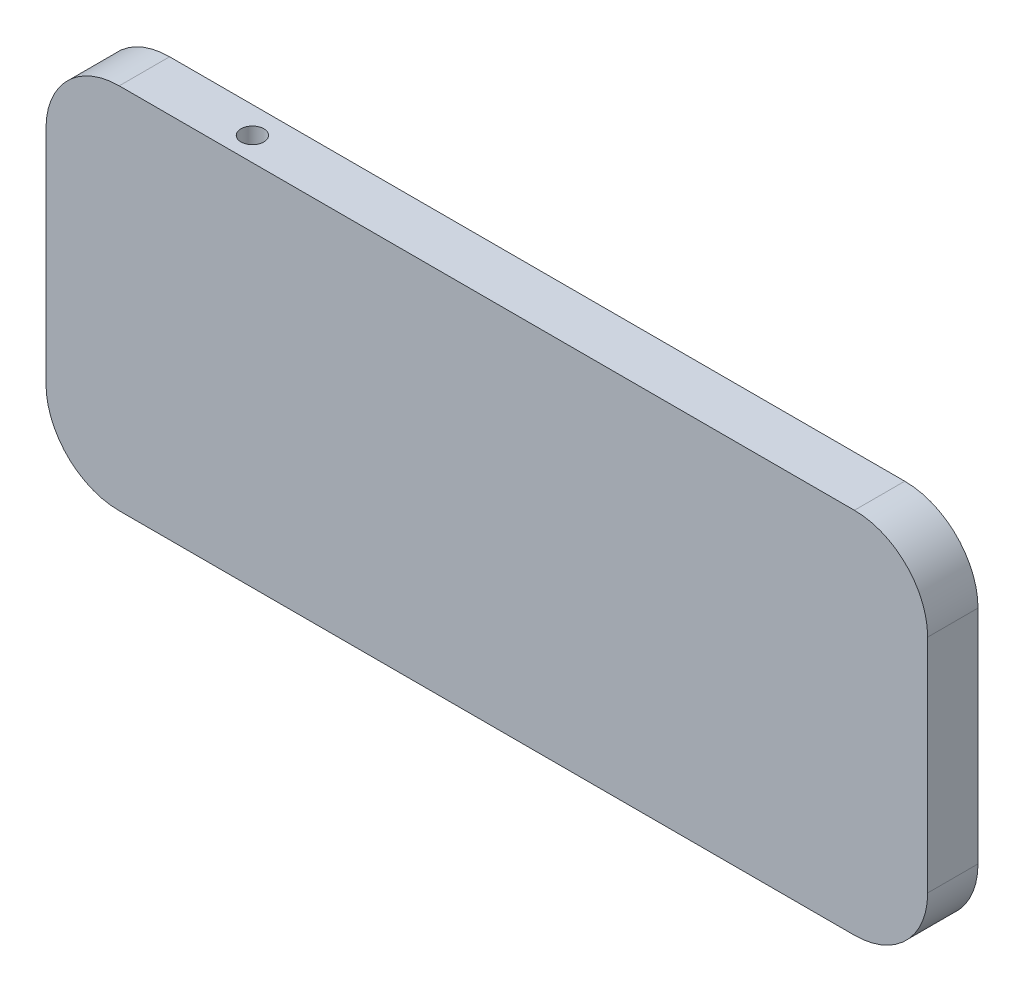
from build123d import *

# Parameters (mm, degrees)
SKETCH1_W           = 172.974
SKETCH1_H           = 102.108
BOSS_EXTRUDE1_DEPTH = 13.97
SKETCH2_R           = 7.4676
SKETCH2_R_2         = 3.014975044
SKETCH2_W           = 7.81218406
SKETCH2_H           = 2.407827673
BOSS_EXTRUDE3_DEPTH = 3.048
SKETCH3_R           = 7.4676
SKETCH3_R_2         = 3.014975044
BOSS_EXTRUDE5_DEPTH = 3.048
SKETCH4_R           = 3.175
CUT_EXTRUDE1_DEPTH  = 11.176


with BuildPart() as part:
    # Sketch1 → Boss-Extrude1 (new body)
    with BuildSketch(Plane.XY):
        with Locations((58.9637029, 33.169946412)):
            Rectangle(SKETCH1_W, SKETCH1_H)
        with BuildLine():
            Line((-27.5232971, 84.223946412), (-43.0172971, 84.223946412))
            ThreePointArc((-43.0172971, 84.223946412), (-57.385706894, 78.272356205), (-63.3372971, 63.903946412))
            Line((-63.3372971, 63.903946412), (-63.3372971, 2.435946412))
            ThreePointArc((-63.3372971, 2.435946412), (-57.385706894, -11.932463382), (-43.0172971, -17.884053588))
            Line((-43.0172971, -17.884053588), (-27.5232971, -17.884053588))
            Line((-27.5232971, -17.884053588), (-27.5232971, 84.223946412))
        make_face()
        with BuildLine():
            Line((160.9447029, 84.223946412), (145.4507029, 84.223946412))
            Line((145.4507029, 84.223946412), (145.4507029, -17.884053588))
            Line((145.4507029, -17.884053588), (160.9447029, -17.884053588))
            ThreePointArc((160.9447029, -17.884053588), (175.313112694, -11.932463382), (181.2647029, 2.435946412))
            Line((181.2647029, 2.435946412), (181.2647029, 63.903946412))
            ThreePointArc((181.2647029, 63.903946412), (175.313112694, 78.272356205), (160.9447029, 84.223946412))
        make_face()
    extrude(amount=BOSS_EXTRUDE1_DEPTH)

    # Sketch2 → Boss-Extrude3 (add)
    with BuildSketch(Plane(origin=(0, 0, 0), x_dir=(-1, 0, 0), z_dir=(0, 0, -1))):
        with Locations(Location((-163.4847029, 58.823946412, 0), (0, 0, 180))):
            Circle(SKETCH2_R)
        with Locations(Location((-170.337090886, 26.676001086, 0), (0, 0, 180))):
            Circle(SKETCH2_R_2)
        with Locations(Location((-163.221177768, 32.823656386, 0), (0, 0, 180))):
            Circle(SKETCH2_R_2)
        with Locations(Location((-156.732358191, 26.205188985, 0), (0, 0, 180))):
            Circle(SKETCH2_R_2)
        with Locations(Location((-163.721455714, 19.973644896, 0), (0, 0, 180))):
            Circle(SKETCH2_R_2)
        with Locations((-152.730393721, 74.856056835)):
            Rectangle(SKETCH2_W, SKETCH2_H)
    extrude(amount=BOSS_EXTRUDE3_DEPTH)

    # Sketch3 → Boss-Extrude5 (add)
    with BuildSketch(Plane(origin=(0, 0, 0), x_dir=(-1, 0, 0), z_dir=(0, 0, -1))):
        with Locations(Location((45.487523866, 28.516423037, 0), (0, 0, 180))):
            Circle(SKETCH3_R)
        with Locations(Location((44.957454366, 53.116068624, 0), (0, 0, 180))):
            Circle(SKETCH3_R_2)
        with Locations(Location((38.341819194, 59.818424813, 0), (0, 0, 180))):
            Circle(SKETCH3_R_2)
        with Locations(Location((45.457732312, 65.966080113, 0), (0, 0, 180))):
            Circle(SKETCH3_R_2)
        with Locations(Location((51.94655189, 59.347612713, 0), (0, 0, 180))):
            Circle(SKETCH3_R_2)
        Polygon((38.47340824, 76.391412748), (41.190295926, 76.391412748), (41.190295926, 73.983585075), (38.47340824, 73.983585075), (38.47340824, 71.443585075), (35.93340824, 71.443585075), (35.93340824, 73.983585075), (33.570295926, 73.983585075), (33.570295926, 76.391412748), (35.93340824, 76.391412748), (35.93340824, 78.931412748), (38.47340824, 78.931412748), align=None)
    extrude(amount=BOSS_EXTRUDE5_DEPTH)

    # Sketch4 → Cut-Extrude1 (cut)
    with BuildSketch(Plane(origin=(0, 84.223946412, 0), x_dir=(1, 0, 0), z_dir=(0, 1, 0))):
        with Locations(Location((-12.641077469, -7.400069152, 0), (0, 0, 270))):
            Circle(SKETCH4_R)
    extrude(amount=-CUT_EXTRUDE1_DEPTH, mode=Mode.SUBTRACT)


solid = part.part
